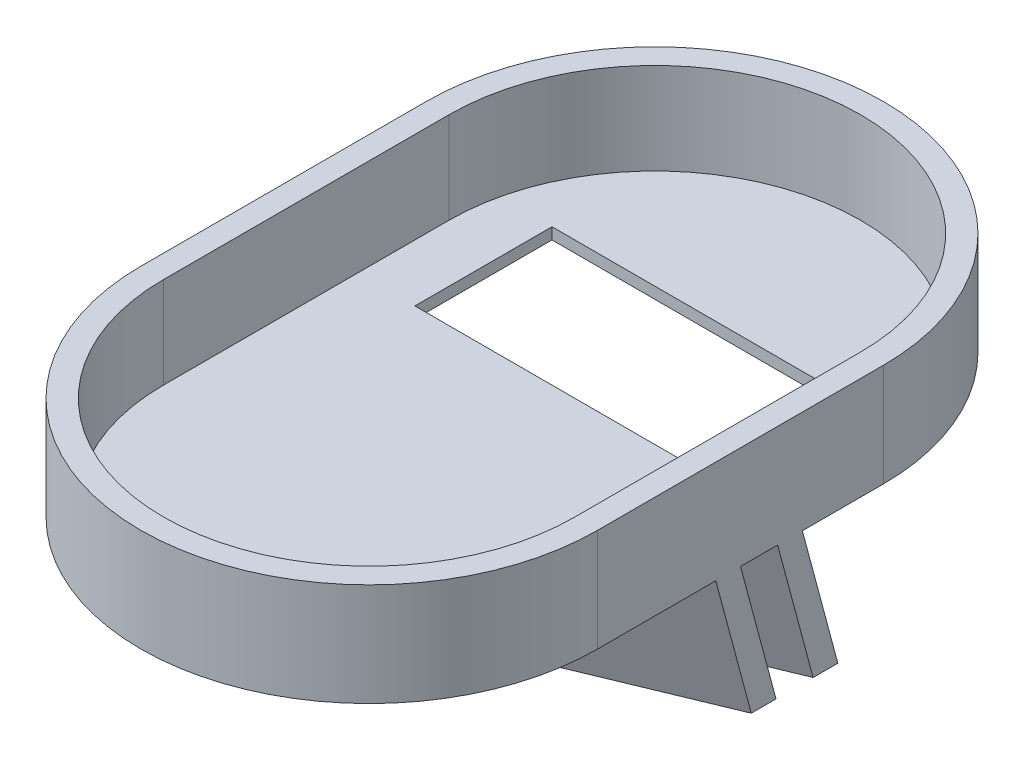
from build123d import *

# Parameters (mm, degrees)
SKETCH1_W           = 26
SKETCH1_H           = 12
BOSS_EXTRUDE1_DEPTH = 1
BOSS_EXTRUDE2_DEPTH = 9
BOSS_EXTRUDE3_DEPTH = 12
FILLET1_R           = 10


with BuildPart() as part:
    # Sketch1 → Boss-Extrude1 (new body)
    with BuildSketch(Plane(origin=(0, 0, 0), x_dir=(1, 0, 0), z_dir=(0, 1, 0))):
        with BuildLine():
            Line((-18, -12.5), (-18, 12.5))
            ThreePointArc((-18, 12.5), (0, 30.5), (18, 12.5))
            Line((18, 12.5), (18, -12.5))
            ThreePointArc((18, -12.5), (0, -30.5), (-18, -12.5))
        make_face()
        with Locations((0, 10.5)):
            Rectangle(SKETCH1_W, SKETCH1_H, mode=Mode.SUBTRACT)
    extrude(amount=BOSS_EXTRUDE1_DEPTH)

    # Sketch2 → Boss-Extrude2 (add)
    with BuildSketch(Plane(origin=(0, 0, 0), x_dir=(1, 0, 0), z_dir=(0, 1, 0))):
        with BuildLine():
            Line((20, -12.5), (20, 12.5))
            ThreePointArc((20, 12.5), (0, 32.5), (-20, 12.5))
            Line((-20, 12.5), (-20, -12.5))
            ThreePointArc((-20, -12.5), (0, -32.5), (20, -12.5))
        make_face()
        with BuildLine():
            Line((18, -12.5), (18, 12.5))
            ThreePointArc((18, 12.5), (0, 30.5), (-18, 12.5))
            Line((-18, 12.5), (-18, -12.5))
            ThreePointArc((-18, -12.5), (0, -30.5), (18, -12.5))
        make_face(mode=Mode.SUBTRACT)
    extrude(amount=BOSS_EXTRUDE2_DEPTH)

    # Sketch3 → Boss-Extrude3 (add, along a direction that is not the sketch's normal)
    with BuildSketch(Plane.XZ):
        Polygon((-20, 0), (0, 8.284271247), (20, 0), (20, 2.164784401), (0, 10.449055648), (-20, 2.164784401), align=None)
        Polygon((-20, -3.247176601), (0, 5.037094647), (20, -3.247176601), (20, -5.411961001), (0, 2.872310246), (-20, -5.411961001), align=None)
    extrude(amount=BOSS_EXTRUDE3_DEPTH, dir=(0, -0.9659258262890672, -0.25881904510252496))

    # Fillet1
    fillet1_edges = [part.edges().sort_by_distance(p)[0] for p in [
        (0, -5.795554958, 6.731356977),
        (0, -5.795554958, 8.896141377),
        (0, -5.795554958, 1.319395975),
        (0, -5.795554958, 3.484180376),
    ]]
    fillet(fillet1_edges, radius=FILLET1_R)


solid = part.part
